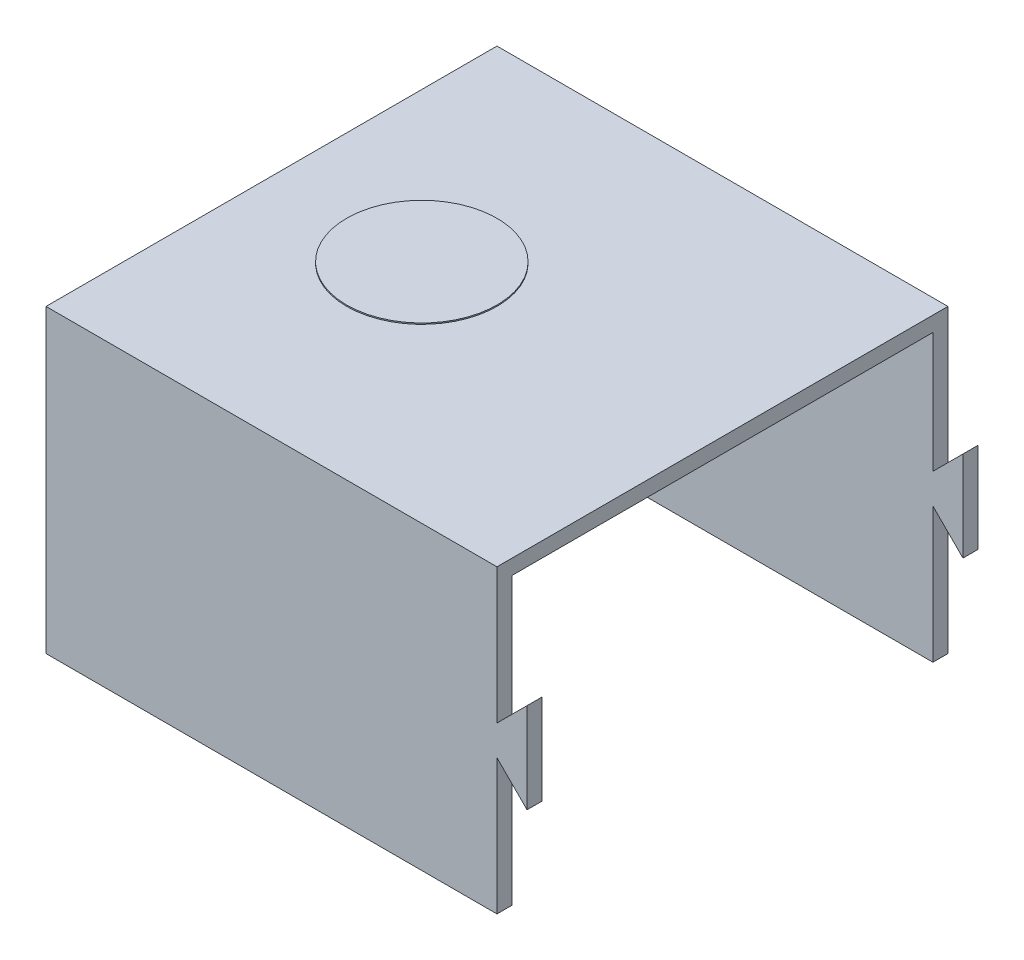
from build123d import *

# Parameters (mm, degrees)
SKETCH_1_W          = 150
SKETCH_1_H          = 150
EXTRUDE_1_DEPTH     = 100
SKETCH_4_R          = 25
EXTRUDE_2_DEPTH     = 0.4
SKETCH_5_W          = 145
SKETCH_5_H          = 140
CUT_EXTRUDE_1_DEPTH = 95
SKETCH_7_W          = 10
SKETCH_7_H          = 10
EXTRUDE_3_DEPTH     = 5
EXTRUDE_4_DEPTH     = 5
SKETCH_10_W         = 10
SKETCH_10_H         = 10
EXTRUDE_5_DEPTH     = 5
EXTRUDE_6_DEPTH     = 5


with BuildPart() as part:
    # 草图1 → 凸台-拉伸1 (new body)
    with BuildSketch(Plane(origin=(0, 0, 0), x_dir=(1, 0, 0), z_dir=(0, 1, 0))):
        with Locations((-43.129330254, -16.974595843)):
            Rectangle(SKETCH_1_W, SKETCH_1_H)
    extrude(amount=EXTRUDE_1_DEPTH)

    # 草图4 → 凸台-拉伸2 (add)
    with BuildSketch(Plane(origin=(0, 100, 0), x_dir=(1, 0, 0), z_dir=(0, 1, 0))):
        with Locations(Location((-68.129330254, -16.974595843, 0), (0, 0, 270))):
            Circle(SKETCH_4_R)
    extrude(amount=EXTRUDE_2_DEPTH)

    # 草图5 → 切除-拉伸1 (cut)
    with BuildSketch(Plane.XZ):
        with Locations((-40.629330254, 16.974595843)):
            Rectangle(SKETCH_5_W, SKETCH_5_H)
    extrude(amount=-CUT_EXTRUDE_1_DEPTH, mode=Mode.SUBTRACT)

    # 草图7 → 凸台-拉伸3 (add)
    with BuildSketch(Plane.XY.offset(91.974595843)):
        with Locations((36.870669746, 50)):
            Rectangle(SKETCH_7_W, SKETCH_7_H)
    extrude(amount=-EXTRUDE_3_DEPTH)

    # 草图9 → 凸台-拉伸4 (add)
    with BuildSketch(Plane.XY.offset(91.974595843)):
        Polygon((31.870669746, 55), (41.870669746, 65), (41.870669746, 55), align=None)
        Polygon((31.870669746, 45), (41.870669746, 45), (41.870669746, 35), align=None)
    extrude(amount=-EXTRUDE_4_DEPTH)

    # 草图10 → 凸台-拉伸5 (add)
    with BuildSketch(Plane(origin=(0, 0, -58.025404157), x_dir=(-1, 0, 0), z_dir=(0, 0, -1))):
        with Locations((-36.870669746, 50)):
            Rectangle(SKETCH_10_W, SKETCH_10_H)
    extrude(amount=-EXTRUDE_5_DEPTH)

    # 草图11 → 凸台-拉伸6 (add)
    with BuildSketch(Plane(origin=(0, 0, -58.025404157), x_dir=(-1, 0, 0), z_dir=(0, 0, -1))):
        Polygon((-31.870669746, 55), (-41.870669746, 65), (-41.870669746, 55), align=None)
        Polygon((-31.870669746, 45), (-41.870669746, 45), (-41.870669746, 35), align=None)
    extrude(amount=-EXTRUDE_6_DEPTH)


solid = part.part
